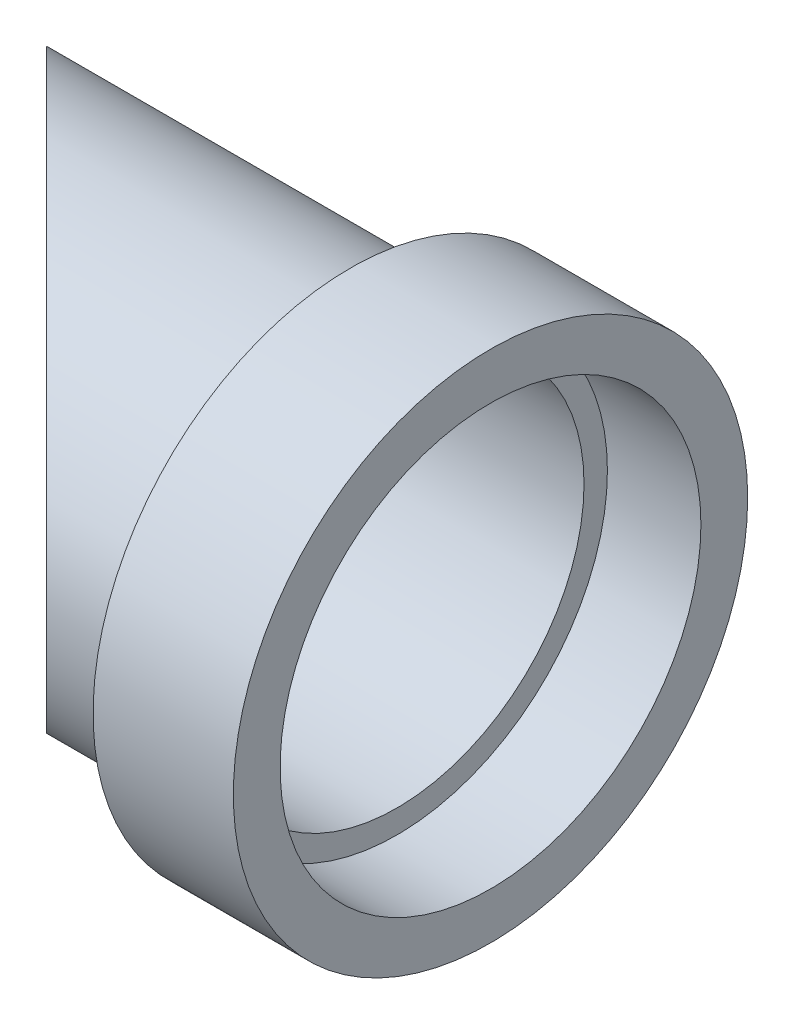
from build123d import *

# Parameters (mm, degrees)
SKETCH3_R                = 57.15
SKETCH3_R_2              = 50.8
BOSS_EXTRUDE2_DEPTH      = 152.4
BOSS_EXTRUDE3_DEPTH      = 25.4
BOSS_EXTRUDE3_DEPTH_BACK = 12.7
SKETCH4_R                = 69.85
SKETCH4_R_2              = 57.15
CUT_EXTRUDE1_DEPTH       = 127
CUT_EXTRUDE1_DEPTH_BACK  = 127


with BuildPart() as part:
    # Sketch3 → Boss-Extrude2 (new body)
    with BuildSketch(Plane(origin=(0, 0, 0), x_dir=(0, 0, -1), z_dir=(1, 0, 0))):
        Circle(SKETCH3_R)
        Circle(SKETCH3_R_2, mode=Mode.SUBTRACT)
    extrude(amount=BOSS_EXTRUDE2_DEPTH)

    # Sketch4 → Boss-Extrude3 (add, two sides: drawn at the far end of the back side and taken through both)
    with BuildSketch(Plane(origin=(152.4, 0, 0), x_dir=(0, 0, -1), z_dir=(1, 0, 0)).offset(-BOSS_EXTRUDE3_DEPTH_BACK)):
        Circle(SKETCH4_R)
        Circle(SKETCH4_R_2, mode=Mode.SUBTRACT)
    extrude(amount=BOSS_EXTRUDE3_DEPTH + BOSS_EXTRUDE3_DEPTH_BACK)

    # Sketch5 → Cut-Extrude1 (cut, two sides: drawn at the far end of the back side and taken through both)
    with BuildSketch(Plane(origin=(0, 0, 0), x_dir=(1, 0, 0), z_dir=(0, 1, 0)).offset(-CUT_EXTRUDE1_DEPTH_BACK)):
        Polygon((0, -57.15), (114.3, -57.15), (0, 57.15), align=None)
    extrude(amount=CUT_EXTRUDE1_DEPTH + CUT_EXTRUDE1_DEPTH_BACK, mode=Mode.SUBTRACT)


solid = part.part
